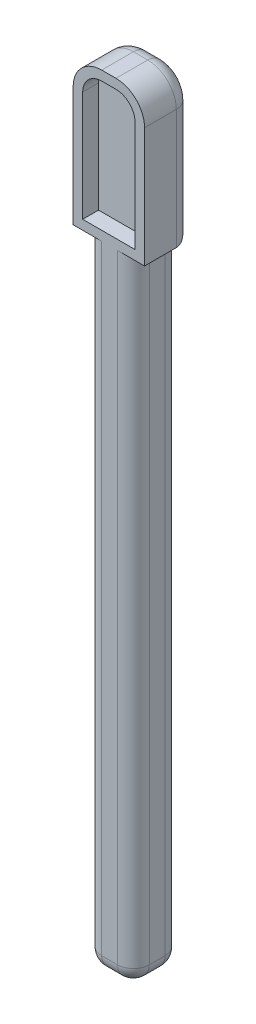
from build123d import *

# Parameters (mm, degrees)
EXTRUDE_1_DEPTH     = 3
CUT_EXTRUDE_1_DEPTH = 1
FILLET_3_R          = 1


with BuildPart() as part:
    # 草图1 → 凸台-拉伸1 (new body)
    with BuildSketch(Plane.XY):
        with BuildLine():
            Line((3, 40), (3.703089902, 40))
            Line((3.703089902, 40), (3.703089902, 47.546153846))
            ThreePointArc((3.703089902, 47.546153846), (3.175882108, 48.818946052), (1.903089902, 49.346153846))
            Line((1.903089902, 49.346153846), (1.003089902, 49.346153846))
            ThreePointArc((1.003089902, 49.346153846), (-0.269702304, 48.818946052), (-0.796910098, 47.546153846))
            Line((-0.796910098, 47.546153846), (-0.796910098, 40))
            Line((-0.796910098, 40), (0, 40))
            Line((0, 40), (0, 0))
            Line((0, 0), (3, 0))
            Line((3, 0), (3, 40))
        make_face()
    extrude(amount=EXTRUDE_1_DEPTH)

    # 草图2 → 切除-拉伸1 (cut)
    with BuildSketch(Plane.XY.offset(3)):
        with BuildLine():
            Line((3.103089902, 40.6), (3.103089902, 47.546153846))
            ThreePointArc((3.103089902, 47.546153846), (2.751618039, 48.394681984), (1.903089902, 48.746153846))
            Line((1.903089902, 48.746153846), (1.003089902, 48.746153846))
            ThreePointArc((1.003089902, 48.746153846), (0.154561764, 48.394681984), (-0.196910098, 47.546153846))
            Line((-0.196910098, 47.546153846), (-0.196910098, 40.6))
            Line((-0.196910098, 40.6), (3.103089902, 40.6))
        make_face()
    extrude(amount=-CUT_EXTRUDE_1_DEPTH, mode=Mode.SUBTRACT)

    # 圆角3
    fillet_3_edges = [part.edges().sort_by_distance(p)[0] for p in [
        (3, 20, 3),
        (-0.269702304, 48.818946052, 0),
        (1.453089902, 49.346153846, 0),
        (3.175882108, 48.818946052, 0),
        (3.703089902, 43.773076923, 0),
        (3.351544951, 40, 0),
        (3, 20, 0),
        (1.5, 0, 0),
        (0, 20, 0),
        (3, 0, 1.5),
        (0, 0, 1.5),
        (0, 20, 3),
        (1.5, 0, 3),
        (-0.398455049, 40, 0),
        (-0.796910098, 43.773076923, 0),
    ]]
    fillet(fillet_3_edges, radius=FILLET_3_R)


solid = part.part
